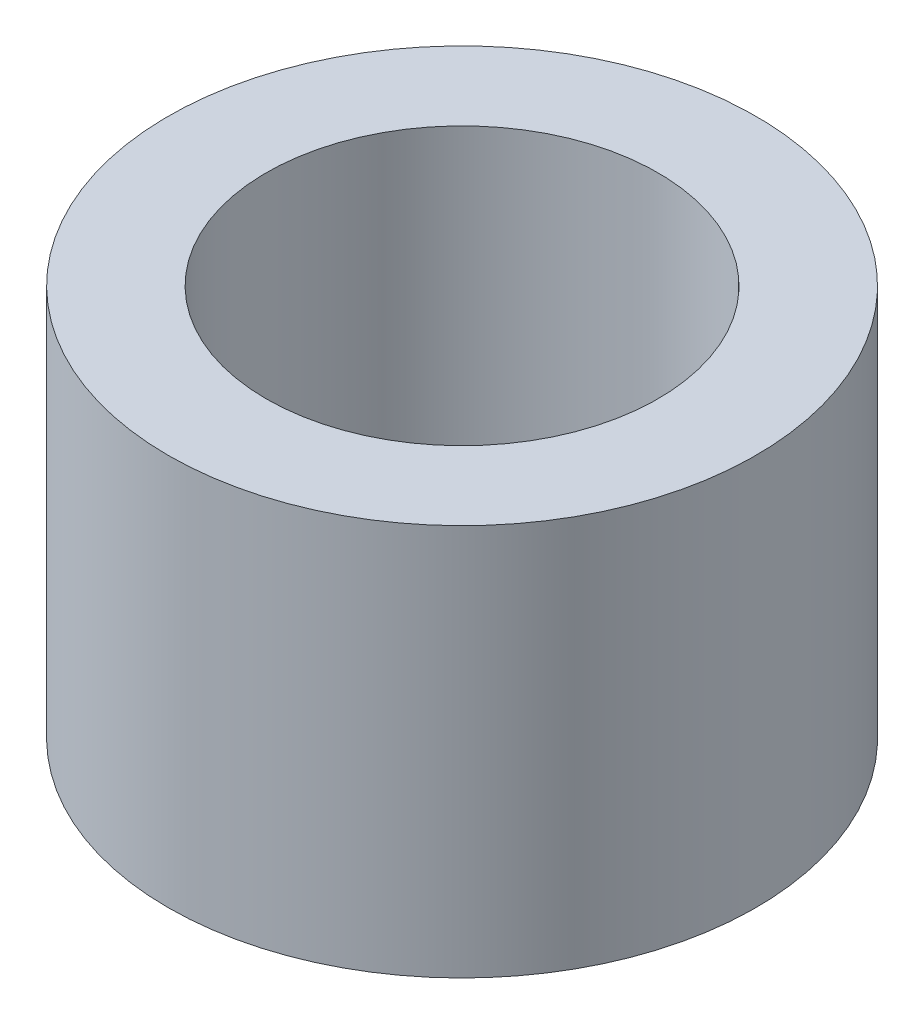
from build123d import *

# Parameters (mm, degrees)
SKETCH_1_R      = 6
SKETCH_1_R_2    = 4
EXTRUDE_1_DEPTH = 8


with BuildPart() as part:
    # Эскиз1 → Бобышка-Вытянуть1 (new body)
    with BuildSketch(Plane(origin=(0, 0, 0), x_dir=(1, 0, 0), z_dir=(0, 1, 0))):
        with Locations(Location((0, 0, 0), (0, 0, 270))):
            Circle(SKETCH_1_R)
        with Locations(Location((0, 0, 0), (0, 0, 270))):
            Circle(SKETCH_1_R_2, mode=Mode.SUBTRACT)
    extrude(amount=EXTRUDE_1_DEPTH)


solid = part.part
